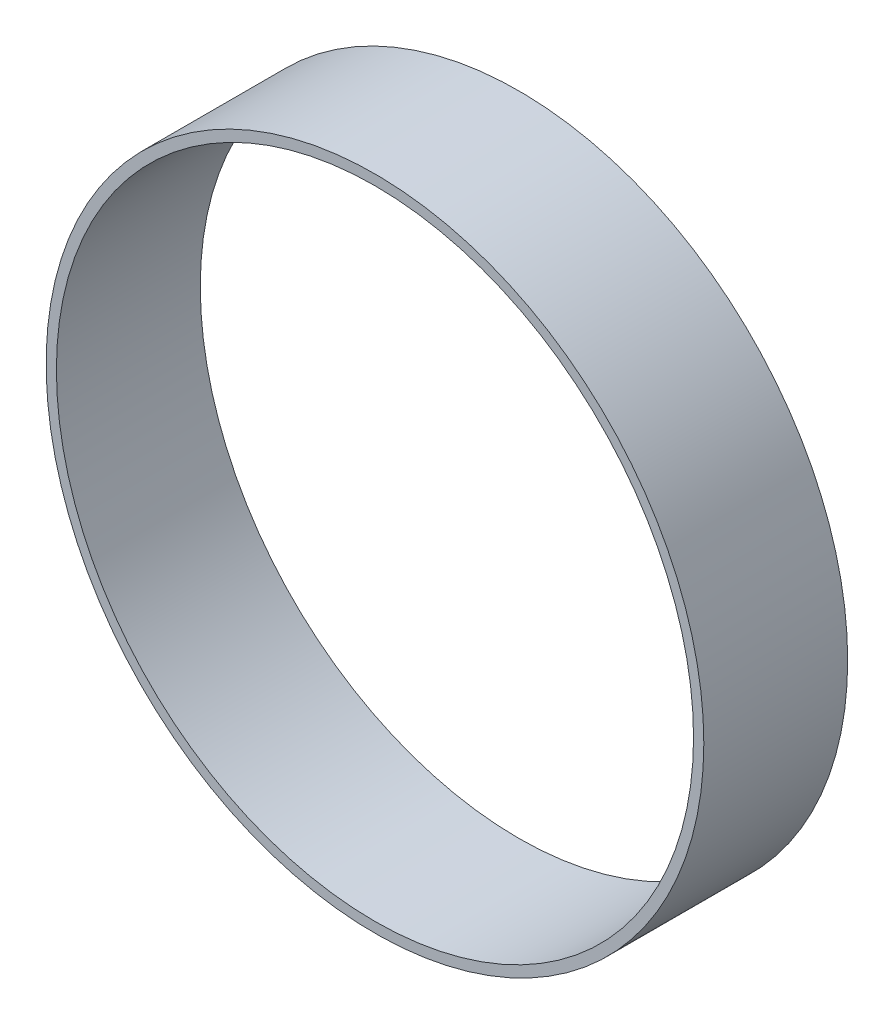
from build123d import *

# Parameters (mm, degrees)
SKETCH1_R           = 50.8
SKETCH1_R_2         = 49.2125
BOSS_EXTRUDE1_DEPTH = 22.225


with BuildPart() as part:
    # Sketch1 → Boss-Extrude1 (new body)
    with BuildSketch(Plane.XY):
        Circle(SKETCH1_R)
        Circle(SKETCH1_R_2, mode=Mode.SUBTRACT)
    extrude(amount=BOSS_EXTRUDE1_DEPTH)


solid = part.part
